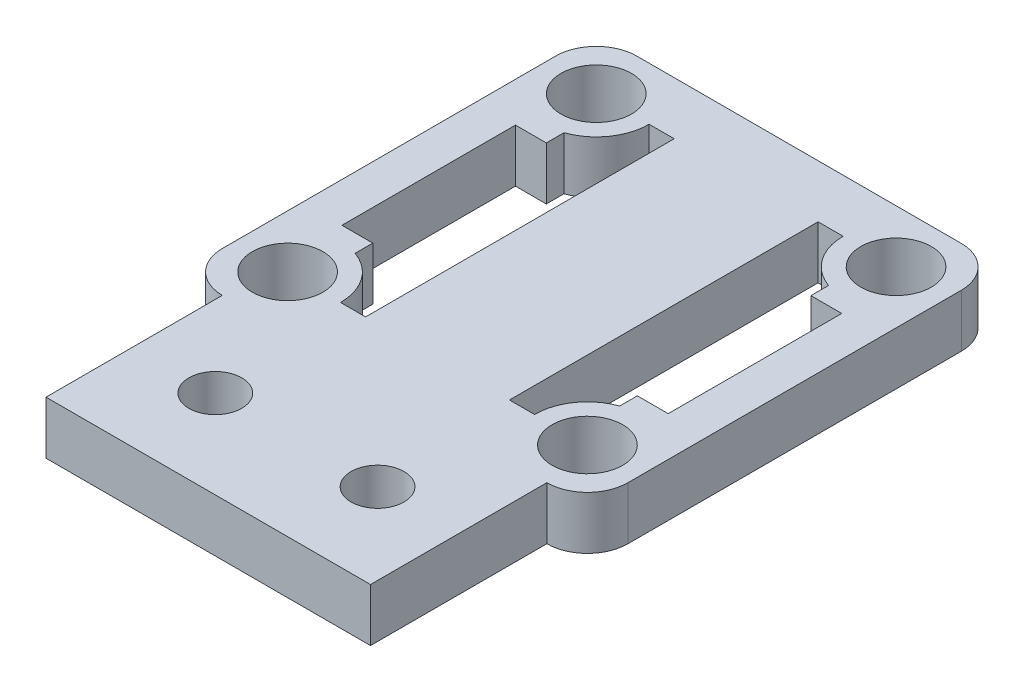
from build123d import *

# Parameters (mm, degrees)
BOSS_EXTRUDE1_DEPTH      = 2
CUT_EXTRUDE2_DEPTH       = 1
SKETCH5_R                = 2
CUT_EXTRUDE3_DEPTH       = 21.942838525
CUT_EXTRUDE4_DEPTH       = 21.942838525
SKETCH7_W                = 18.4
SKETCH7_H                = 1
BOSS_EXTRUDE2_DEPTH      = 10
SKETCH8_R                = 1.5
CUT_EXTRUDE5_DEPTH       = 25.092211634
CUT_EXTRUDE6_DEPTH       = 1
SKETCH11_W               = 1.421057218
SKETCH11_H               = 17.5
SKETCH11_W_2             = 1.75
SKETCH11_H_2             = 9.84
CUT_EXTRUDE7_DEPTH       = 25.092211634
BOSS_EXTRUDE3_START      = 2
BOSS_EXTRUDE3_DEPTH      = 2
CUT_EXTRUDE8_DEPTH       = 25.154392176
CUT_EXTRUDE8_DEPTH_BACK  = 25.154392176
CUT_EXTRUDE9_DEPTH       = 25.154392176
CUT_EXTRUDE9_DEPTH_BACK  = 25.154392176
CUT_EXTRUDE10_DEPTH      = 25.154392176
CUT_EXTRUDE10_DEPTH_BACK = 25.154392176
SKETCH15_R               = 1.5
CUT_EXTRUDE11_DEPTH      = 25.154392176
CUT_EXTRUDE11_DEPTH_BACK = 25.154392176
SKETCH16_R               = 1.5
CUT_EXTRUDE12_DEPTH      = 25.154392176
CUT_EXTRUDE12_DEPTH_BACK = 25.154392176
SKETCH17_R               = 2
BOSS_EXTRUDE4_START      = 1
BOSS_EXTRUDE4_DEPTH      = 1
CUT_EXTRUDE13_DEPTH      = 25.257672217
CUT_EXTRUDE13_DEPTH_BACK = 25.257672217
SKETCH19_R               = 2
CUT_EXTRUDE14_START      = -1
CUT_EXTRUDE14_DEPTH      = 1


with BuildPart() as part:
    # Sketch1 → Boss-Extrude1 (new body)
    with BuildSketch(Plane(origin=(0, 0, 0), x_dir=(1, 0, 0), z_dir=(0, 1, 0))):
        with BuildLine():
            Line((-12.649074074, 14.633101852), (5.750925926, 14.633101852))
            ThreePointArc((5.750925926, 14.633101852), (7.377271523, 13.959447449), (8.050925926, 12.333101852))
            Line((8.050925926, 12.333101852), (8.050925926, -6.566898148))
            ThreePointArc((8.050925926, -6.566898148), (7.377271523, -8.193243745), (5.750925926, -8.866898148))
            Line((5.750925926, -8.866898148), (-12.649074074, -8.866898148))
            ThreePointArc((-12.649074074, -8.866898148), (-14.275419671, -8.193243745), (-14.949074074, -6.566898148))
            Line((-14.949074074, -6.566898148), (-14.949074074, 12.333101852))
            ThreePointArc((-14.949074074, 12.333101852), (-14.275419671, 13.959447449), (-12.649074074, 14.633101852))
        make_face()
    extrude(amount=BOSS_EXTRUDE1_DEPTH)

    # Sketch2 → Cut-Extrude2 (cut)
    with BuildSketch(Plane(origin=(0, 2, 0), x_dir=(1, 0, 0), z_dir=(0, 1, 0))):
        with BuildLine():
            Line((5.750925926, 13.633101852), (-12.649074074, 13.633101852))
            ThreePointArc((-12.649074074, 13.633101852), (-13.56831289, 13.252340667), (-13.949074074, 12.333101852))
            Line((-13.949074074, 12.333101852), (-13.949074074, -6.566898148))
            ThreePointArc((-13.949074074, -6.566898148), (-13.56831289, -7.486136964), (-12.649074074, -7.866898148))
            Line((-12.649074074, -7.866898148), (5.750925926, -7.866898148))
            ThreePointArc((5.750925926, -7.866898148), (6.670164741, -7.486136964), (7.050925926, -6.566898148))
            Line((7.050925926, -6.566898148), (7.050925926, 12.333101852))
            ThreePointArc((7.050925926, 12.333101852), (6.670164741, 13.252340667), (5.750925926, 13.633101852))
        make_face()
    extrude(amount=-CUT_EXTRUDE2_DEPTH, mode=Mode.SUBTRACT)

    # Sketch5 → Cut-Extrude3 (cut, through all)
    with BuildSketch(Plane(origin=(0, 1, 0), x_dir=(1, 0, 0), z_dir=(0, 1, 0))):
        with Locations(Location((5.050925926, 11.633101852, 0), (0, 0, 270))):
            Circle(SKETCH5_R)
        with Locations(Location((5.050925926, -5.866898148, 0), (0, 0, 270))):
            Circle(SKETCH5_R)
        with Locations(Location((-11.949074074, -5.866898148, 0), (0, 0, 270))):
            Circle(SKETCH5_R)
        with Locations(Location((-11.949074074, 11.633101852, 0), (0, 0, 90))):
            Circle(SKETCH5_R)
    extrude(amount=-CUT_EXTRUDE3_DEPTH, mode=Mode.SUBTRACT)

    # Sketch6 → Cut-Extrude4 (cut, through all)
    with BuildSketch(Plane(origin=(0, 1, 0), x_dir=(1, 0, 0), z_dir=(0, 1, 0))):
        with BuildLine():
            Line((4.050925926, -3.038471023), (4.050925926, 8.804674727))
            ThreePointArc((4.050925926, 8.804674727), (2.601436183, 9.901051044), (2.050925926, 11.633101852))
            Line((2.050925926, 11.633101852), (2.050925926, -5.866898148))
            ThreePointArc((2.050925926, -5.866898148), (2.601436183, -4.134847341), (4.050925926, -3.038471023))
        make_face()
        with BuildLine():
            Line((-10.949074074, 8.804674727), (-10.949074074, -3.038471023))
            ThreePointArc((-10.949074074, -3.038471023), (-9.499584331, -4.134847341), (-8.949074074, -5.866898148))
            Line((-8.949074074, -5.866898148), (-8.949074074, 11.633101852))
            ThreePointArc((-8.949074074, 11.633101852), (-9.499584331, 9.901051044), (-10.949074074, 8.804674727))
        make_face()
    extrude(amount=-CUT_EXTRUDE4_DEPTH, mode=Mode.SUBTRACT)

    # Sketch7 → Boss-Extrude2 (add)
    with BuildSketch(Plane.XY.offset(8.866898148)):
        with Locations((-3.449074074, 0.5)):
            Rectangle(SKETCH7_W, SKETCH7_H)
    extrude(amount=BOSS_EXTRUDE2_DEPTH)

    # Sketch8 → Cut-Extrude5 (cut, through all)
    with BuildSketch(Plane(origin=(0, 1, 0), x_dir=(1, 0, 0), z_dir=(0, 1, 0))):
        with Locations(Location((1.150925926, -13.866898148, 0), (0, 0, 270))):
            Circle(SKETCH8_R)
        with Locations(Location((-8.049074074, -13.866898148, 0), (0, 0, 270))):
            Circle(SKETCH8_R)
    extrude(amount=-CUT_EXTRUDE5_DEPTH, mode=Mode.SUBTRACT)

    # Sketch9 → Cut-Extrude6 (cut)
    with BuildSketch(Plane(origin=(0, 2, 0), x_dir=(1, 0, 0), z_dir=(0, 1, 0))):
        with BuildLine():
            Line((5.750925926, 13.833101852), (-12.649074074, 13.833101852))
            ThreePointArc((-12.649074074, 13.833101852), (-13.709734246, 13.393762024), (-14.149074074, 12.333101852))
            Line((-14.149074074, 12.333101852), (-14.149074074, -6.566898148))
            ThreePointArc((-14.149074074, -6.566898148), (-13.709734246, -7.62755832), (-12.649074074, -8.066898148))
            Line((-12.649074074, -8.066898148), (5.750925926, -8.066898148))
            ThreePointArc((5.750925926, -8.066898148), (6.811586098, -7.62755832), (7.250925926, -6.566898148))
            Line((7.250925926, -6.566898148), (7.250925926, 12.333101852))
            ThreePointArc((7.250925926, 12.333101852), (6.811586098, 13.393762024), (5.750925926, 13.833101852))
        make_face()
    extrude(amount=-CUT_EXTRUDE6_DEPTH, mode=Mode.SUBTRACT)

    # Sketch11 → Cut-Extrude7 (cut, through all)
    with BuildSketch(Plane(origin=(0, 1, 0), x_dir=(1, 0, 0), z_dir=(0, 1, 0))):
        with Locations((-8.238545465, 2.883101852)):
            Rectangle(SKETCH11_W, SKETCH11_H)
        with Locations((1.340397317, 2.883101852)):
            Rectangle(SKETCH11_W, SKETCH11_H)
        with Locations((-11.824074074, 2.883101852)):
            Rectangle(SKETCH11_W_2, SKETCH11_H_2)
        with Locations((4.925925926, 2.883101852)):
            Rectangle(SKETCH11_W_2, SKETCH11_H_2)
    extrude(amount=-CUT_EXTRUDE7_DEPTH, mode=Mode.SUBTRACT)

    # Sketch12 → Boss-Extrude3 (add)
    with BuildSketch(Plane.XZ.offset(BOSS_EXTRUDE3_START)):
        with BuildLine():
            Line((8.050925926, -12.333101852), (8.050925926, 6.566898148))
            ThreePointArc((8.050925926, 6.566898148), (7.377271523, 8.193243745), (5.750925926, 8.866898148))
            Line((5.750925926, 8.866898148), (5.750925926, 18.866898148))
            Line((5.750925926, 18.866898148), (-12.649074074, 18.866898148))
            Line((-12.649074074, 18.866898148), (-12.649074074, 8.866898148))
            ThreePointArc((-12.649074074, 8.866898148), (-14.275419671, 8.193243745), (-14.949074074, 6.566898148))
            Line((-14.949074074, 6.566898148), (-14.949074074, -12.333101852))
            ThreePointArc((-14.949074074, -12.333101852), (-14.275419671, -13.959447449), (-12.649074074, -14.633101852))
            Line((-12.649074074, -14.633101852), (5.750925926, -14.633101852))
            ThreePointArc((5.750925926, -14.633101852), (7.377271523, -13.959447449), (8.050925926, -12.333101852))
        make_face()
    extrude(amount=-BOSS_EXTRUDE3_DEPTH)

    # Sketch13 → Cut-Extrude8 (cut, two sides: drawn at the far end of the back side and taken through both)
    with BuildSketch(Plane(origin=(0, 0, 0), x_dir=(1, 0, 0), z_dir=(0, 1, 0)).offset(-CUT_EXTRUDE8_DEPTH_BACK)):
        with BuildLine():
            Line((-12.699074074, 7.803101852), (-12.699074074, -2.036898148))
            Line((-12.699074074, -2.036898148), (-10.949074074, -2.036898148))
            Line((-10.949074074, -2.036898148), (-10.949074074, -3.038471023))
            ThreePointArc((-10.949074074, -3.038471023), (-9.499584331, -4.134847341), (-8.949074074, -5.866898148))
            Line((-8.949074074, -5.866898148), (-7.528016856, -5.866898148))
            Line((-7.528016856, -5.866898148), (-7.528016856, 11.633101852))
            Line((-7.528016856, 11.633101852), (-8.949074074, 11.633101852))
            ThreePointArc((-8.949074074, 11.633101852), (-9.499584331, 9.901051044), (-10.949074074, 8.804674727))
            Line((-10.949074074, 8.804674727), (-10.949074074, 7.803101852))
            Line((-10.949074074, 7.803101852), (-12.699074074, 7.803101852))
        make_face()
    extrude(amount=CUT_EXTRUDE8_DEPTH + CUT_EXTRUDE8_DEPTH_BACK, mode=Mode.SUBTRACT)

    # Sketch14 → Cut-Extrude9 (cut, two sides: drawn at the far end of the back side and taken through both)
    with BuildSketch(Plane(origin=(0, 0, 0), x_dir=(1, 0, 0), z_dir=(0, 1, 0)).offset(-CUT_EXTRUDE9_DEPTH_BACK)):
        with BuildLine():
            Line((0.629868708, -5.866898148), (2.050925926, -5.866898148))
            ThreePointArc((2.050925926, -5.866898148), (2.601436183, -4.134847341), (4.050925926, -3.038471023))
            Line((4.050925926, -3.038471023), (4.050925926, -2.036898148))
            Line((4.050925926, -2.036898148), (5.800925926, -2.036898148))
            Line((5.800925926, -2.036898148), (5.800925926, 7.803101852))
            Line((5.800925926, 7.803101852), (4.050925926, 7.803101852))
            Line((4.050925926, 7.803101852), (4.050925926, 8.804674727))
            ThreePointArc((4.050925926, 8.804674727), (2.601436183, 9.901051044), (2.050925926, 11.633101852))
            Line((2.050925926, 11.633101852), (0.629868708, 11.633101852))
            Line((0.629868708, 11.633101852), (0.629868708, -5.866898148))
        make_face()
    extrude(amount=CUT_EXTRUDE9_DEPTH + CUT_EXTRUDE9_DEPTH_BACK, mode=Mode.SUBTRACT)

    # Sketch15 → Cut-Extrude10 (cut, two sides: drawn at the far end of the back side and taken through both)
    with BuildSketch(Plane(origin=(0, 0, 0), x_dir=(1, 0, 0), z_dir=(0, 1, 0)).offset(-CUT_EXTRUDE10_DEPTH_BACK)):
        with Locations(Location((-8.049074074, -13.866898148, 0), (0, 0, 270))):
            Circle(SKETCH15_R)
    extrude(amount=CUT_EXTRUDE10_DEPTH + CUT_EXTRUDE10_DEPTH_BACK, mode=Mode.SUBTRACT)

    # Sketch16 → Cut-Extrude11 (cut, two sides: drawn at the far end of the back side and taken through both)
    with BuildSketch(Plane(origin=(0, 0, 0), x_dir=(1, 0, 0), z_dir=(0, 1, 0)).offset(-CUT_EXTRUDE11_DEPTH_BACK)):
        with Locations(Location((1.150925926, -13.866898148, 0), (0, 0, 270))):
            Circle(SKETCH16_R)
    extrude(amount=CUT_EXTRUDE11_DEPTH + CUT_EXTRUDE11_DEPTH_BACK, mode=Mode.SUBTRACT)

    # Sketch17 → Cut-Extrude12 (cut, two sides: drawn at the far end of the back side and taken through both)
    with BuildSketch(Plane(origin=(0, 0, 0), x_dir=(1, 0, 0), z_dir=(0, 1, 0)).offset(-CUT_EXTRUDE12_DEPTH_BACK)):
        with Locations(Location((-11.949074074, -5.866898148, 0), (0, 0, 270))):
            Circle(SKETCH17_R)
        with Locations(Location((5.050925926, -5.866898148, 0), (0, 0, 270))):
            Circle(SKETCH17_R)
        with Locations(Location((-11.949074074, 11.633101852, 0), (0, 0, 270))):
            Circle(SKETCH17_R)
        with Locations(Location((5.050925926, 11.633101852, 0), (0, 0, 270))):
            Circle(SKETCH17_R)
    extrude(amount=CUT_EXTRUDE12_DEPTH + CUT_EXTRUDE12_DEPTH_BACK, mode=Mode.SUBTRACT)

    # Sketch18 → Boss-Extrude4 (add)
    with BuildSketch(Plane(origin=(0, 1, 0), x_dir=(1, 0, 0), z_dir=(0, 1, 0)).offset(BOSS_EXTRUDE4_START)):
        with BuildLine():
            Line((5.750925926, 13.833101852), (-12.649074074, 13.833101852))
            ThreePointArc((-12.649074074, 13.833101852), (-13.709734246, 13.393762024), (-14.149074074, 12.333101852))
            Line((-14.149074074, 12.333101852), (-14.149074074, -6.566898148))
            ThreePointArc((-14.149074074, -6.566898148), (-13.709734246, -7.62755832), (-12.649074074, -8.066898148))
            Line((-12.649074074, -8.066898148), (5.750925926, -8.066898148))
            ThreePointArc((5.750925926, -8.066898148), (6.811586098, -7.62755832), (7.250925926, -6.566898148))
            Line((7.250925926, -6.566898148), (7.250925926, 12.333101852))
            ThreePointArc((7.250925926, 12.333101852), (6.811586098, 13.393762024), (5.750925926, 13.833101852))
        make_face()
    extrude(amount=-BOSS_EXTRUDE4_DEPTH)

    # Sketch19 → Cut-Extrude13 (cut, two sides: drawn at the far end of the back side and taken through both)
    with BuildSketch(Plane.XZ.offset(-1).offset(-CUT_EXTRUDE13_DEPTH_BACK)):
        with Locations(Location((5.050925926, -11.633101852, 0), (0, 0, 90))):
            Circle(SKETCH19_R)
        with Locations(Location((-11.949074074, -11.633101852, 0), (0, 0, 90))):
            Circle(SKETCH19_R)
        with Locations(Location((-11.949074074, 5.866898148, 0), (0, 0, 90))):
            Circle(SKETCH19_R)
        with Locations(Location((5.050925926, 5.866898148, 0), (0, 0, 90))):
            Circle(SKETCH19_R)
        with BuildLine():
            Line((-10.949074074, 3.038471023), (-10.949074074, 2.036898148))
            Line((-10.949074074, 2.036898148), (-12.699074074, 2.036898148))
            Line((-12.699074074, 2.036898148), (-12.699074074, -7.803101852))
            Line((-12.699074074, -7.803101852), (-10.949074074, -7.803101852))
            Line((-10.949074074, -7.803101852), (-10.949074074, -8.804674727))
            ThreePointArc((-10.949074074, -8.804674727), (-9.499584331, -9.901051044), (-8.949074074, -11.633101852))
            Line((-8.949074074, -11.633101852), (-7.528016856, -11.633101852))
            Line((-7.528016856, -11.633101852), (-7.528016856, 5.866898148))
            Line((-7.528016856, 5.866898148), (-8.949074074, 5.866898148))
            ThreePointArc((-8.949074074, 5.866898148), (-9.499584331, 4.134847341), (-10.949074074, 3.038471023))
        make_face()
        with BuildLine():
            Line((4.050925926, 2.036898148), (4.050925926, 3.038471023))
            ThreePointArc((4.050925926, 3.038471023), (2.601436183, 4.134847341), (2.050925926, 5.866898148))
            Line((2.050925926, 5.866898148), (0.629868708, 5.866898148))
            Line((0.629868708, 5.866898148), (0.629868708, -11.633101852))
            Line((0.629868708, -11.633101852), (2.050925926, -11.633101852))
            ThreePointArc((2.050925926, -11.633101852), (2.601436183, -9.901051044), (4.050925926, -8.804674727))
            Line((4.050925926, -8.804674727), (4.050925926, -7.803101852))
            Line((4.050925926, -7.803101852), (5.800925926, -7.803101852))
            Line((5.800925926, -7.803101852), (5.800925926, 2.036898148))
            Line((5.800925926, 2.036898148), (4.050925926, 2.036898148))
        make_face()
    extrude(amount=CUT_EXTRUDE13_DEPTH + CUT_EXTRUDE13_DEPTH_BACK, mode=Mode.SUBTRACT)

    # Sketch20 → Cut-Extrude14 (cut)
    with BuildSketch(Plane(origin=(0, 2, 0), x_dir=(1, 0, 0), z_dir=(0, 1, 0)).offset(CUT_EXTRUDE14_START)):
        with BuildLine():
            Line((5.750925926, 14.633101852), (-12.649074074, 14.633101852))
            ThreePointArc((-12.649074074, 14.633101852), (-14.275419671, 13.959447449), (-14.949074074, 12.333101852))
            Line((-14.949074074, 12.333101852), (-14.949074074, -6.566898148))
            ThreePointArc((-14.949074074, -6.566898148), (-14.275419671, -8.193243745), (-12.649074074, -8.866898148))
            Line((-12.649074074, -8.866898148), (5.750925926, -8.866898148))
            ThreePointArc((5.750925926, -8.866898148), (7.377271523, -8.193243745), (8.050925926, -6.566898148))
            Line((8.050925926, -6.566898148), (8.050925926, 12.333101852))
            ThreePointArc((8.050925926, 12.333101852), (7.377271523, 13.959447449), (5.750925926, 14.633101852))
        make_face()
    extrude(amount=CUT_EXTRUDE14_DEPTH, mode=Mode.SUBTRACT)


solid = part.part
